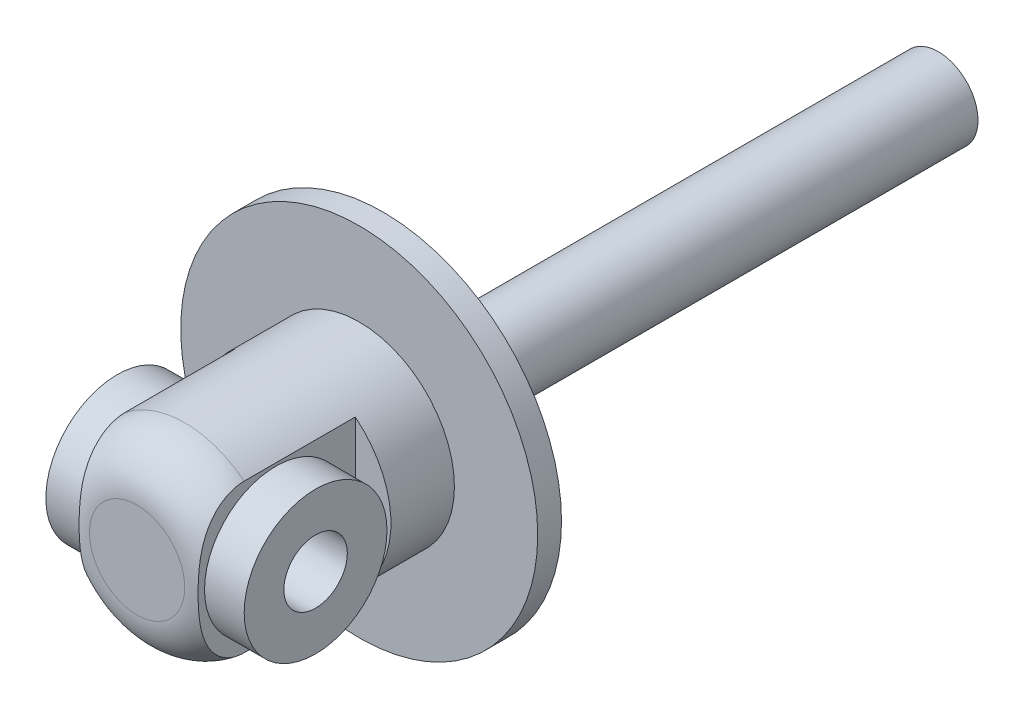
from build123d import *

# Parameters (mm, degrees)
SKETCH1_R           = 5
BOSS_EXTRUDE1_DEPTH = 70
SKETCH2_R           = 22.5
BOSS_EXTRUDE2_DEPTH = 3
SKETCH3_R           = 12
BOSS_EXTRUDE3_DEPTH = 28
FILLET1_R           = 6
SKETCH4_W           = 10
SKETCH4_H           = 20
CUT_EXTRUDE1_DEPTH  = 14
SKETCH5_R           = 4
CUT_EXTRUDE2_DEPTH  = 108.736948259
SKETCH6_R           = 9
BOSS_EXTRUDE4_DEPTH = 12.5
SKETCH7_R           = 4
CUT_EXTRUDE3_DEPTH  = 110.234838857


with BuildPart() as part:
    # Sketch1 → Boss-Extrude1 (new body)
    with BuildSketch(Plane(origin=(0, 0, 0), x_dir=(0, 1, 0), z_dir=(0, 0, 1))):
        with Locations(Location((0, 0, 0), (0, 0, 270))):
            Circle(SKETCH1_R)
    extrude(amount=BOSS_EXTRUDE1_DEPTH)

    # Sketch2 → Boss-Extrude2 (add)
    with BuildSketch(Plane.XY.offset(70)):
        Circle(SKETCH2_R)
    extrude(amount=BOSS_EXTRUDE2_DEPTH)

    # Sketch3 → Boss-Extrude3 (add)
    with BuildSketch(Plane.XY.offset(73)):
        Circle(SKETCH3_R)
    extrude(amount=BOSS_EXTRUDE3_DEPTH)

    # Fillet1
    fillet1_edges = [part.edges().sort_by_distance(p)[0] for p in [
        (-12, 0, 101),
    ]]
    fillet(fillet1_edges, radius=FILLET1_R)

    # Sketch4 → Cut-Extrude1 (cut, symmetric)
    with BuildSketch(Plane(origin=(0, 0, 0), x_dir=(-1, 0, 0), z_dir=(0, 1, 0))):
        with Locations((12.5, 91)):
            Rectangle(SKETCH4_W, SKETCH4_H)
        with Locations((-12.5, 91)):
            Rectangle(SKETCH4_W, SKETCH4_H)
    extrude(amount=CUT_EXTRUDE1_DEPTH, both=True, mode=Mode.SUBTRACT)

    # Sketch5 → Cut-Extrude2 (cut, through all)
    with BuildSketch(Plane.YZ.offset(7.5)):
        with Locations(Location((0, 91, 0), (0, 0, 270))):
            Circle(SKETCH5_R)
    extrude(amount=-CUT_EXTRUDE2_DEPTH, mode=Mode.SUBTRACT)

    # Sketch6 → Boss-Extrude4 (add, symmetric)
    with BuildSketch(Plane.YZ):
        with Locations(Location((0, 91, 0), (0, 0, 90))):
            Circle(SKETCH6_R)
    extrude(amount=BOSS_EXTRUDE4_DEPTH, both=True)

    # Sketch7 → Cut-Extrude3 (cut, through all)
    with BuildSketch(Plane(origin=(-12.5, 0, 0), x_dir=(0, -1, 0), z_dir=(-1, 0, 0))):
        with Locations(Location((0, 91, 0), (0, 0, 90))):
            Circle(SKETCH7_R)
    extrude(amount=-CUT_EXTRUDE3_DEPTH, mode=Mode.SUBTRACT)


solid = part.part
